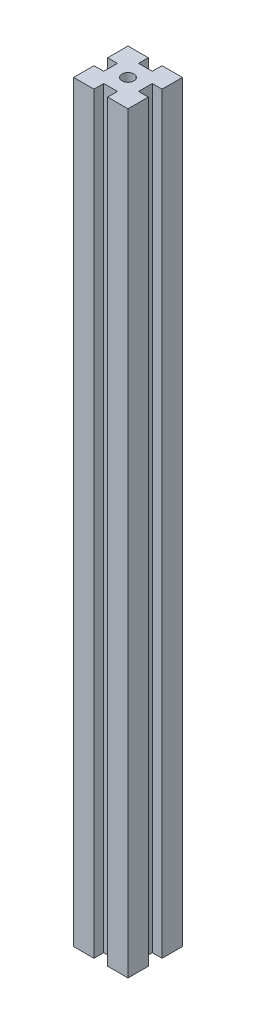
from build123d import *

# Parameters (mm, degrees)
SKETCH1_R           = 2.75
BOSS_EXTRUDE1_DEPTH = 346


with BuildPart() as part:
    # Sketch1 → Boss-Extrude1 (new body)
    with BuildSketch(Plane(origin=(0, 0, 0), x_dir=(1, 0, 0), z_dir=(0, 1, 0))):
        Polygon((9.35, 25), (9.35, 20.5), (15.65, 20.5), (15.65, 25), (25, 25), (25, 15.65), (20.5, 15.65), (20.5, 9.35), (25, 9.35), (25, 0), (15.65, 0), (15.65, 4.5), (9.35, 4.5), (9.35, 0), (0, 0), (0, 9.35), (4.5, 9.35), (4.5, 15.65), (0, 15.65), (0, 25), align=None)
        with Locations(Location((12.5, 12.5, 0), (0, 0, 270))):
            Circle(SKETCH1_R, mode=Mode.SUBTRACT)
    extrude(amount=BOSS_EXTRUDE1_DEPTH)


solid = part.part
